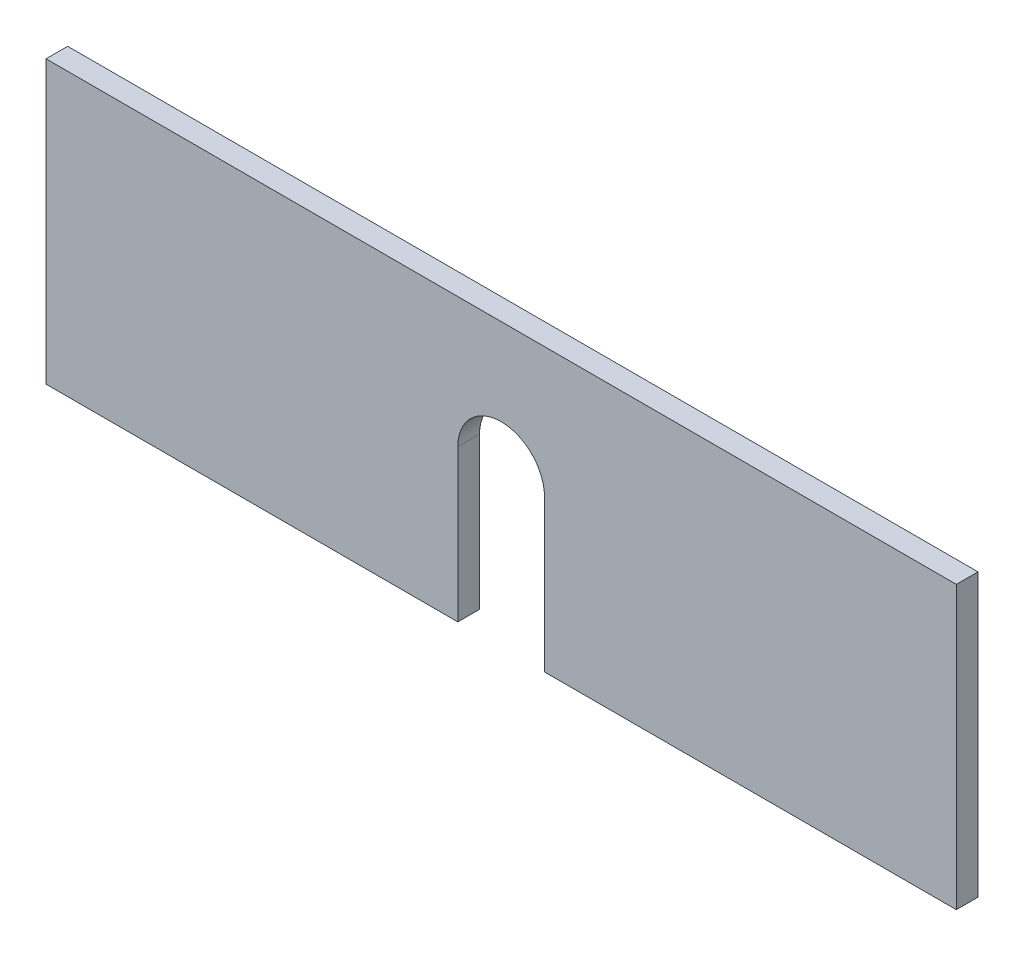
from build123d import *

# Parameters (mm, degrees)
BOSS_EXTRUDE1_DEPTH = 5


with BuildPart() as part:
    # Sketch1 → Boss-Extrude1 (new body)
    with BuildSketch(Plane.XY):
        with BuildLine():
            Line((-43.047808765, 2.768924303), (-43.047808765, -32.231075697))
            Line((-43.047808765, -32.231075697), (-138.047808765, -32.231075697))
            Line((-138.047808765, -32.231075697), (-138.047808765, 32.768924303))
            Line((-138.047808765, 32.768924303), (71.952191235, 32.768924303))
            Line((71.952191235, 32.768924303), (71.952191235, -32.231075697))
            Line((71.952191235, -32.231075697), (-23.047808765, -32.231075697))
            Line((-23.047808765, -32.231075697), (-23.047808765, 2.768924303))
            ThreePointArc((-23.047808765, 2.768924303), (-33.047808765, 12.768924303), (-43.047808765, 2.768924303))
        make_face()
    extrude(amount=BOSS_EXTRUDE1_DEPTH)


solid = part.part
